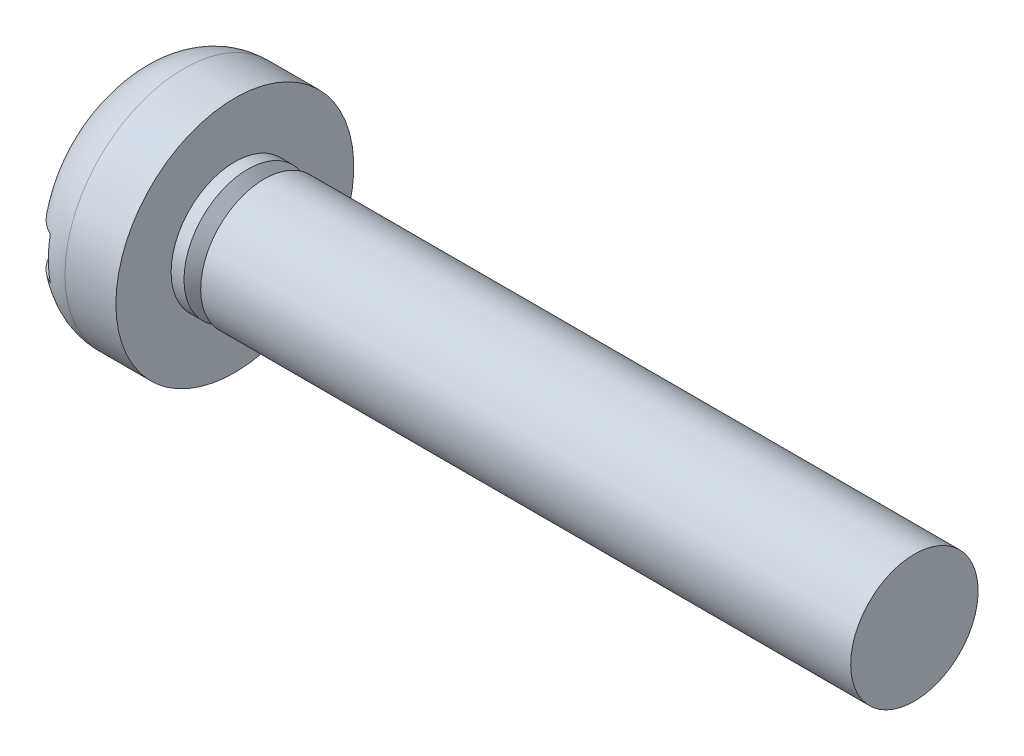
from build123d import *

# Parameters (mm, degrees)
SKETCH2_W  = 5.6
SKETCH2_H  = 1
SLOT_DEPTH = 0.7


with BuildPart() as part:
    # BodySke → Base-Revolve (revolve)
    with BuildSketch(Plane.XY, mode=Mode.PRIVATE) as base_revolve_sk:
        with BuildLine():
            Line((2.4, 1.5), (2.4, 2.8))
            Line((2.4, 2.8), (1.2, 2.8))
            ThreePointArc((1.2, 2.8), (0.351471863, 2.448528137), (0, 1.6))
            Line((0, 1.6), (0, 0))
            Line((0, 0), (18.4, 0))
            Line((18.4, 0), (18.4, 1.5))
            Line((18.4, 1.5), (2.4, 1.5))
        make_face()
    revolve(base_revolve_sk.sketch.rotate(Axis((-25.4, 0, 0), (1, 0, 0)), 90), axis=Axis((-25.4, 0, 0), (1, 0, 0)))

    # Sketch2 → Slot (cut)
    with BuildSketch(Plane(origin=(0, 0, 0), x_dir=(0, 0, -1), z_dir=(1, 0, 0))):
        Rectangle(SKETCH2_W, SKETCH2_H)
    extrude(amount=SLOT_DEPTH, mode=Mode.SUBTRACT)

    # ThdSchSke → ThreadSchematic (revolve, cut)
    with BuildSketch(Plane.XY):
        Polygon((2.9, -1.2195), (2.703591786, -1.5), (2.703591786, -1.875), (3.096408214, -1.875), (3.096408214, -1.5), align=None)
    revolve(axis=Axis((-3.175, 0, 0), (1, 0, 0)), mode=Mode.SUBTRACT)


solid = part.part
